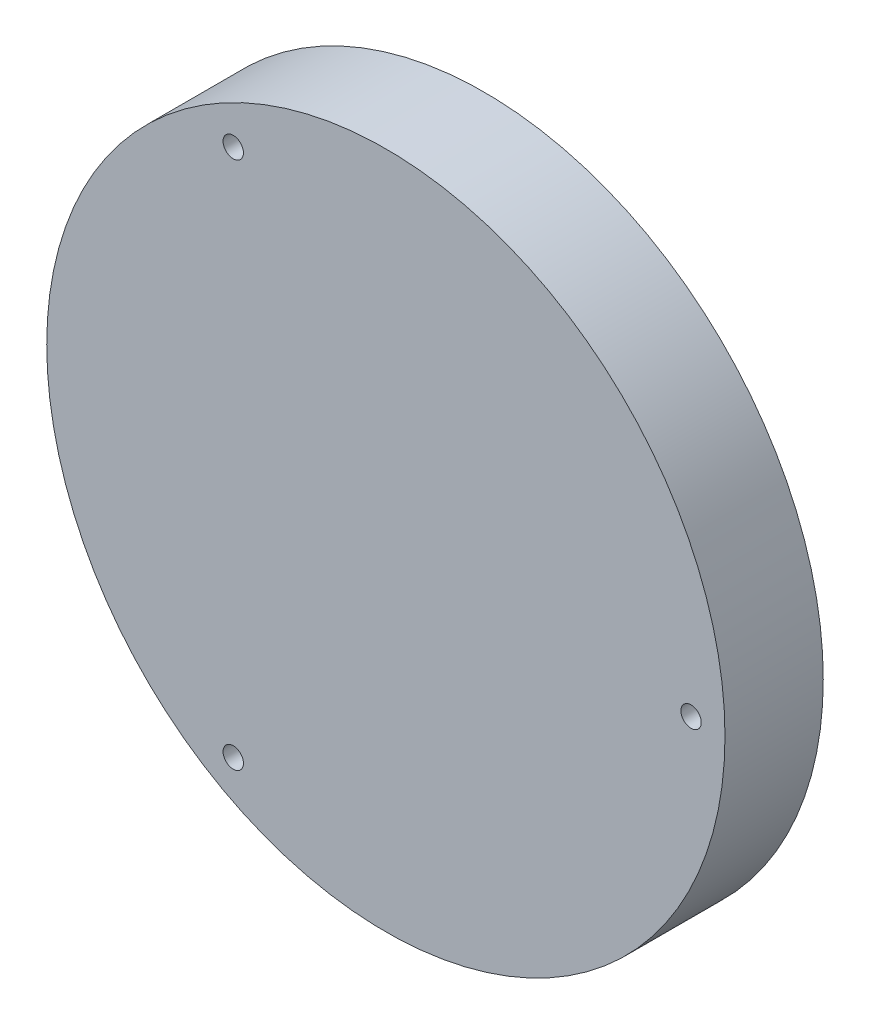
from build123d import *

# Parameters (mm, degrees)
SKETCH2_R           = 50
SKETCH2_R_2         = 1.5
BOSS_EXTRUDE1_DEPTH = 14.488631768


with BuildPart() as part:
    # Sketch2 → Boss-Extrude1 (new body)
    with BuildSketch(Plane(origin=(0, 0, 0), x_dir=(0, 1, 0), z_dir=(0, 0, 1))):
        with Locations(Location((0, 0, 0), (0, 0, 270))):
            Circle(SKETCH2_R)
        with Locations(Location((-38.97114317, 22.5, 0), (0, 0, 270))):
            Circle(SKETCH2_R_2, mode=Mode.SUBTRACT)
        with Locations(Location((38.97114317, 22.5, 0), (0, 0, 270))):
            Circle(SKETCH2_R_2, mode=Mode.SUBTRACT)
        with Locations(Location((0, -45, 0), (0, 0, 270))):
            Circle(SKETCH2_R_2, mode=Mode.SUBTRACT)
    extrude(amount=BOSS_EXTRUDE1_DEPTH)


solid = part.part
